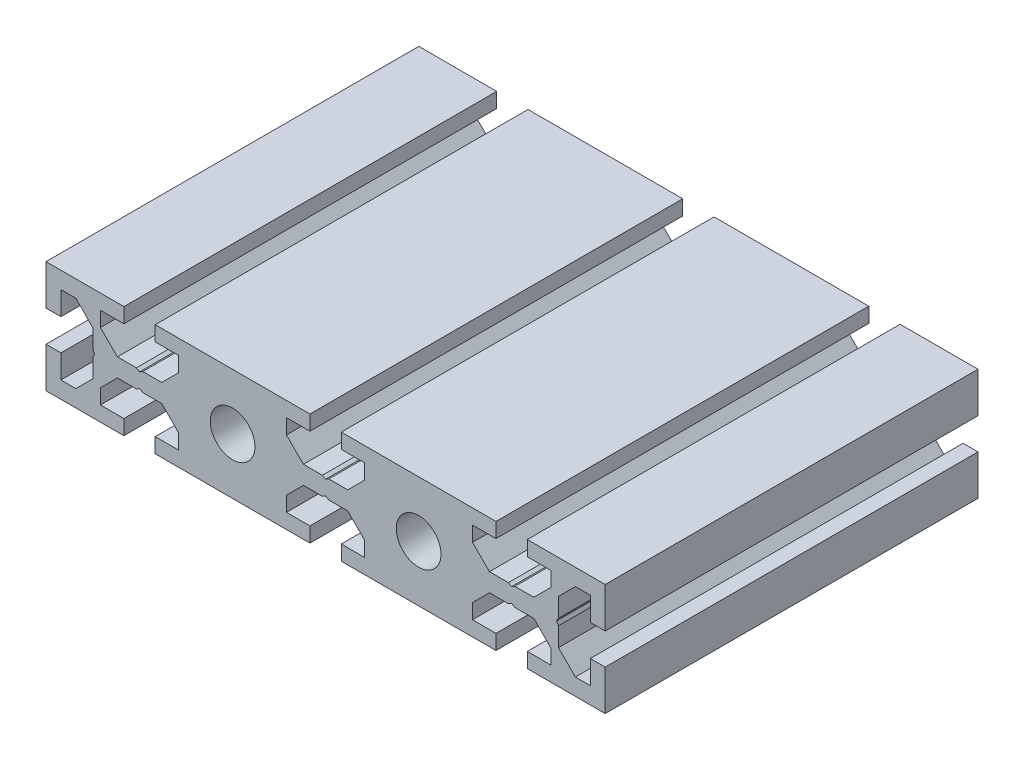
from build123d import *

# Parameters (mm, degrees)
SKETCH_1_R      = 6
EXTRUDE_1_DEPTH = 100


with BuildPart() as part:
    # 草图1 → 凸台-拉伸1 (new body)
    with BuildSketch(Plane.XY):
        Polygon((99.95, 4.2), (99.95, 15), (79.05, 15), (79.05, 11), (85.35, 11), (85.35, 7), (80.8, 2.45), (75.716025404, 2.45), (74.85, 1.95), (73.983974596, 2.45), (68.9, 2.45), (64.35, 7), (64.35, 11), (70.65, 11), (70.65, 15), (29.15, 15), (29.15, 11), (35.45, 11), (35.45, 7), (30.9, 2.45), (25.816025404, 2.45), (24.95, 1.95), (24.083974596, 2.45), (19, 2.45), (14.45, 7), (14.45, 11), (20.75, 11), (20.75, 15), (-20.75, 15), (-20.75, 11), (-14.45, 11), (-14.45, 7), (-19, 2.45), (-24.083974596, 2.45), (-24.95, 1.95), (-25.816025404, 2.45), (-30.9, 2.45), (-35.45, 7), (-35.45, 11), (-29.15, 11), (-29.15, 15), (-50.05, 15), (-50.05, 4.2), (-46.05, 4.2), (-46.05, 10.5), (-42.05, 10.5), (-37.5, 5.95), (-37.5, 0.866025404), (-37, 0), (-37.5, -0.866025404), (-37.5, -5.95), (-42.05, -10.5), (-46.05, -10.5), (-46.05, -4.2), (-50.05, -4.2), (-50.05, -15), (-29.15, -15), (-29.15, -11), (-35.45, -11), (-35.45, -7), (-30.9, -2.45), (-25.816025404, -2.45), (-24.95, -1.95), (-24.083974596, -2.45), (-19, -2.45), (-14.45, -7), (-14.45, -11), (-20.75, -11), (-20.75, -15), (20.75, -15), (20.75, -11), (14.45, -11), (14.45, -7), (19, -2.45), (24.083974596, -2.45), (24.95, -1.95), (25.816025404, -2.45), (30.9, -2.45), (35.45, -7), (35.45, -11), (29.15, -11), (29.15, -15), (70.65, -15), (70.65, -11), (64.35, -11), (64.35, -7), (68.9, -2.45), (73.983974596, -2.45), (74.85, -1.95), (75.716025404, -2.45), (80.8, -2.45), (85.35, -7), (85.35, -11), (79.05, -11), (79.05, -15), (99.95, -15), (99.95, -4.2), (95.95, -4.2), (95.95, -10.5), (91.95, -10.5), (87.4, -5.95), (87.4, -0.866025404), (86.9, 0), (87.4, 0.866025404), (87.4, 5.95), (91.95, 10.5), (95.95, 10.5), (95.95, 4.2), align=None)
        Circle(SKETCH_1_R, mode=Mode.SUBTRACT)
        with Locations((49.9, 0)):
            Circle(SKETCH_1_R, mode=Mode.SUBTRACT)
    extrude(amount=EXTRUDE_1_DEPTH)


solid = part.part
